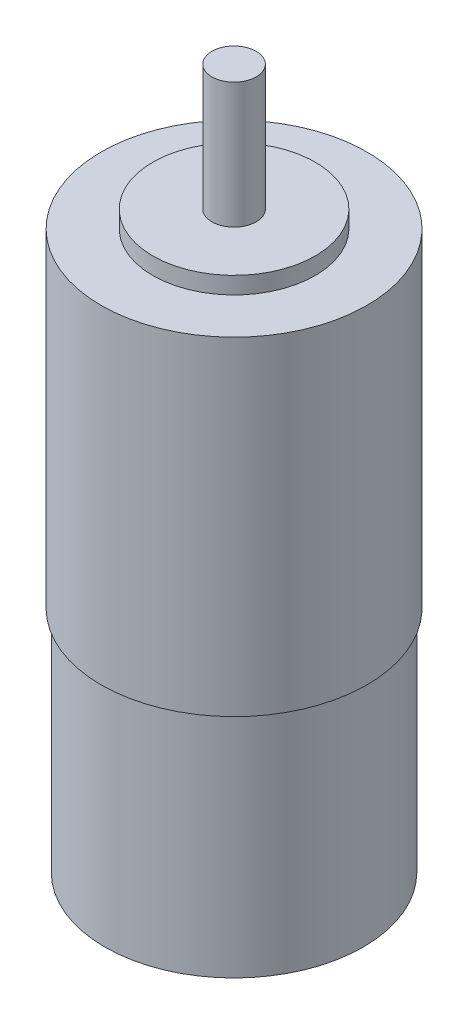
from build123d import *

# Parameters (mm, degrees)
SKETCH_1_R      = 17.5
EXTRUDE_1_DEPTH = 31
SKETCH_2_R      = 18
EXTRUDE_2_DEPTH = 44.5
SKETCH_3_R      = 11
EXTRUDE_3_DEPTH = 2.3
SKETCH_4_R      = 3
EXTRUDE_4_DEPTH = 17


with BuildPart() as part:
    # 草图1 → 凸台-拉伸1 (new body)
    with BuildSketch(Plane(origin=(0, 0, 0), x_dir=(1, 0, 0), z_dir=(0, 1, 0))):
        with Locations(Location((0, 0, 0), (0, 0, 270))):
            Circle(SKETCH_1_R)
    extrude(amount=EXTRUDE_1_DEPTH)

    # 草图2 → 凸台-拉伸2 (add)
    with BuildSketch(Plane(origin=(0, 31, 0), x_dir=(1, 0, 0), z_dir=(0, 1, 0))):
        with Locations(Location((0, 0, 0), (0, 0, 270))):
            Circle(SKETCH_2_R)
    extrude(amount=EXTRUDE_2_DEPTH)

    # 草图3 → 凸台-拉伸3 (add)
    with BuildSketch(Plane(origin=(0, 75.5, 0), x_dir=(1, 0, 0), z_dir=(0, 1, 0))):
        with Locations(Location((0, 0, 0), (0, 0, 270))):
            Circle(SKETCH_3_R)
    extrude(amount=EXTRUDE_3_DEPTH)

    # 草图4 → 凸台-拉伸4 (add)
    with BuildSketch(Plane(origin=(0, 77.8, 0), x_dir=(1, 0, 0), z_dir=(0, 1, 0))):
        with Locations(Location((0, 0, 0), (0, 0, 270))):
            Circle(SKETCH_4_R)
    extrude(amount=EXTRUDE_4_DEPTH)


solid = part.part
